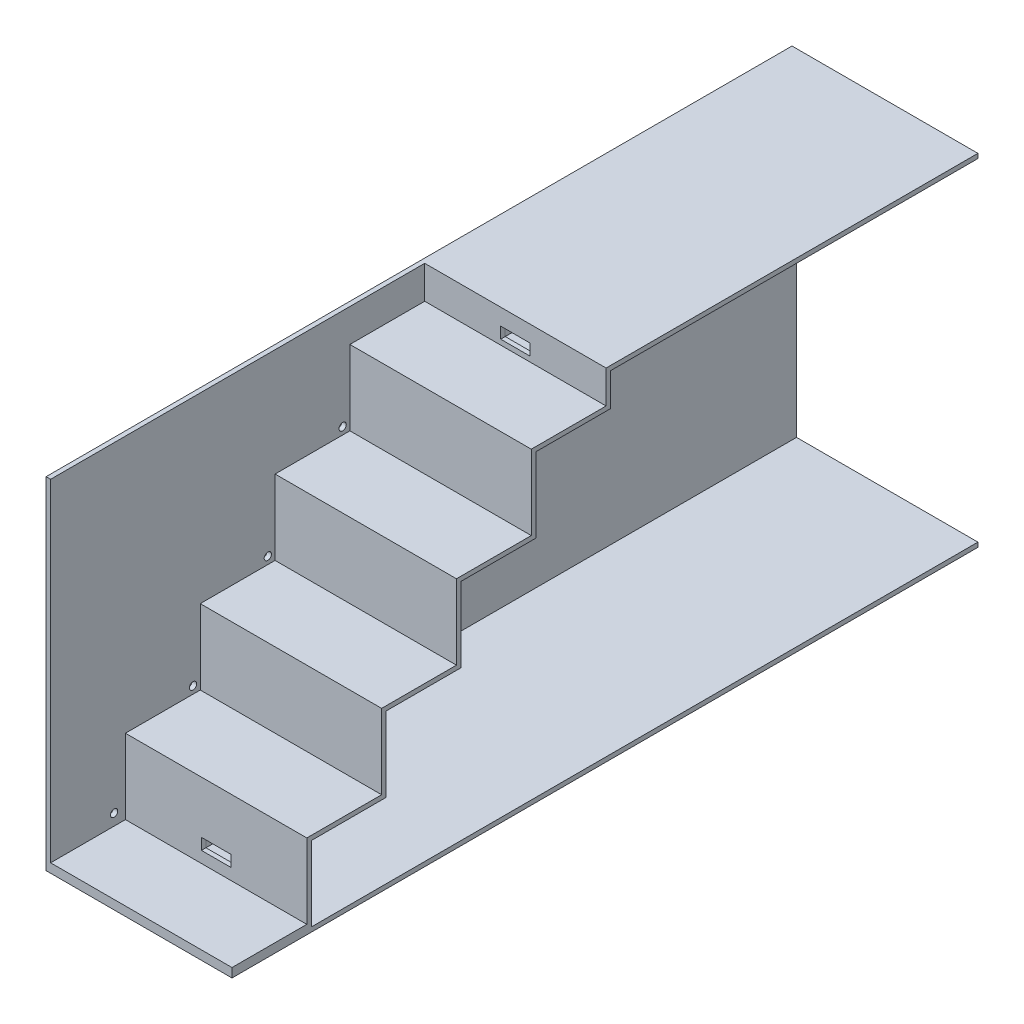
from build123d import *

# Parameters (mm, degrees)
BOSS_EXTRUDE1_DEPTH = 80
SKETCH3_W           = 299
SKETCH3_H           = 299
BOSS_EXTRUDE2_DEPTH = 2
SKETCH4_W           = 82
SKETCH4_H           = 299
BOSS_EXTRUDE3_DEPTH = 2
SKETCH6_W           = 299
SKETCH6_H           = 150.5
CUT_EXTRUDE1_DEPTH  = 82
SKETCH7_W           = 132
SKETCH7_H           = 2
BOSS_EXTRUDE5_DEPTH = 80
SKETCH8_R           = 1.6
CUT_EXTRUDE2_DEPTH  = 2
CUT_EXTRUDE3_START  = -134
SKETCH9_W           = 13
SKETCH9_H           = 5
CUT_EXTRUDE3_DEPTH  = 134
SKETCH10_W          = 18
SKETCH10_H          = 10
SKETCH10_W_2        = 14
SKETCH10_H_2        = 6
BOSS_EXTRUDE6_DEPTH = 10
SKETCH11_W          = 18
SKETCH11_H          = 10
SKETCH11_W_2        = 14
SKETCH11_H_2        = 6
BOSS_EXTRUDE7_DEPTH = 10
BOSS_EXTRUDE8_DEPTH = 30


with BuildPart() as part:
    # Sketch1 → Boss-Extrude1 (new body)
    with BuildSketch(Plane(origin=(0, 0, 0), x_dir=(0, 0, -1), z_dir=(1, 0, 0))):
        Polygon((-23.931657395, -26.597399746), (-23.931657395, 6.402600254), (9.068342605, 6.402600254), (9.068342605, 39.402600254), (42.068342605, 39.402600254), (42.068342605, 72.402600254), (75.068342605, 72.402600254), (75.068342605, 105.402600254), (108.068342605, 105.402600254), (108.068342605, 138.402600254), (141.068342605, 138.402600254), (141.068342605, 171.402600254), (174.068342605, 171.402600254), (174.068342605, 204.402600254), (207.068342605, 204.402600254), (207.068342605, 237.402600254), (240.068342605, 237.402600254), (240.068342605, 272.402600254), (238.068342605, 272.402600254), (238.068342605, 239.402600254), (205.068342605, 239.402600254), (205.068342605, 206.402600254), (172.068342605, 206.402600254), (172.068342605, 173.402600254), (139.068342605, 173.402600254), (139.068342605, 140.402600254), (106.068342605, 140.402600254), (106.068342605, 107.402600254), (73.068342605, 107.402600254), (73.068342605, 74.402600254), (40.068342605, 74.402600254), (40.068342605, 41.402600254), (7.068342605, 41.402600254), (7.068342605, 8.402600254), (-25.931657395, 8.402600254), (-25.931657395, -24.597399746), (-58.931657395, -24.597399746), (-58.931657395, -26.597399746), align=None)
    extrude(amount=BOSS_EXTRUDE1_DEPTH)

    # Sketch3 → Boss-Extrude2 (add)
    with BuildSketch(Plane.ZY):
        with Locations((-90.568342605, 122.902600254)):
            Rectangle(SKETCH3_W, SKETCH3_H)
    extrude(amount=BOSS_EXTRUDE2_DEPTH)

    # Sketch4 → Boss-Extrude3 (add)
    with BuildSketch(Plane.XZ.offset(26.597399746)):
        with Locations((39, -90.568342605)):
            Rectangle(SKETCH4_W, SKETCH4_H)
    extrude(amount=BOSS_EXTRUDE3_DEPTH)

    # Sketch6 → Cut-Extrude1 (cut)
    with BuildSketch(Plane.ZY.offset(2)):
        with Locations((-90.568342605, 197.152600254)):
            Rectangle(SKETCH6_W, SKETCH6_H)
    extrude(amount=-CUT_EXTRUDE1_DEPTH, mode=Mode.SUBTRACT)

    # Sketch7 → Boss-Extrude5 (add)
    with BuildSketch(Plane(origin=(0, 0, 0), x_dir=(0, 0, -1), z_dir=(1, 0, 0))):
        with Locations((174.068342605, 120.902600254)):
            Rectangle(SKETCH7_W, SKETCH7_H)
    extrude(amount=BOSS_EXTRUDE5_DEPTH)

    # Sketch8 → Cut-Extrude2 (cut)
    with BuildSketch(Plane(origin=(0, 0, 0), x_dir=(0, 0, -1), z_dir=(1, 0, 0))):
        with Locations((-30.931657395, -19.597399746)):
            Circle(SKETCH8_R)
        with Locations((3.868342605, 11.602600254)):
            Circle(SKETCH8_R)
        with Locations((36.868342605, 44.602600254)):
            Circle(SKETCH8_R)
        with Locations((69.868342605, 77.602600254)):
            Circle(SKETCH8_R)
    extrude(amount=-CUT_EXTRUDE2_DEPTH, mode=Mode.SUBTRACT)

    # Sketch9 → Cut-Extrude3 (cut)
    with BuildSketch(Plane.XY.offset(25.931657395).offset(CUT_EXTRUDE3_START)):
        with Locations((40, -17.097399746)):
            Rectangle(SKETCH9_W, SKETCH9_H)
        with Locations((40, 112.170516798)):
            Rectangle(SKETCH9_W, SKETCH9_H)
    extrude(amount=CUT_EXTRUDE3_DEPTH, mode=Mode.SUBTRACT)

    # Sketch10 → Boss-Extrude6 (add)
    with BuildSketch(Plane.XY.offset(25.931657395)):
        with Locations((40, -17.097399746)):
            Rectangle(SKETCH10_W, SKETCH10_H)
        with Locations((40, -17.097399746)):
            Rectangle(SKETCH10_W_2, SKETCH10_H_2, mode=Mode.SUBTRACT)
    extrude(amount=-BOSS_EXTRUDE6_DEPTH)

    # Sketch11 → Boss-Extrude7 (add)
    with BuildSketch(Plane(origin=(0, 0, -108.068342605), x_dir=(-1, 0, 0), z_dir=(0, 0, -1))):
        with Locations((-40, 112.170516798)):
            Rectangle(SKETCH11_W, SKETCH11_H)
        with Locations((-40, 112.170516798)):
            Rectangle(SKETCH11_W_2, SKETCH11_H_2, mode=Mode.SUBTRACT)
    extrude(amount=BOSS_EXTRUDE7_DEPTH)

    # Sketch12 → Boss-Extrude8 (add)
    with BuildSketch(Plane(origin=(0, 0, -240.068342605), x_dir=(-1, 0, 0), z_dir=(0, 0, -1))):
        Polygon((2, -28.597399746), (2, 121.902600254), (-80, 121.902600254), (-80, 119.902600254), (0, 119.902600254), (0, -26.597399746), (-80, -26.597399746), (-80, -28.597399746), align=None)
    extrude(amount=BOSS_EXTRUDE8_DEPTH)


solid = part.part
